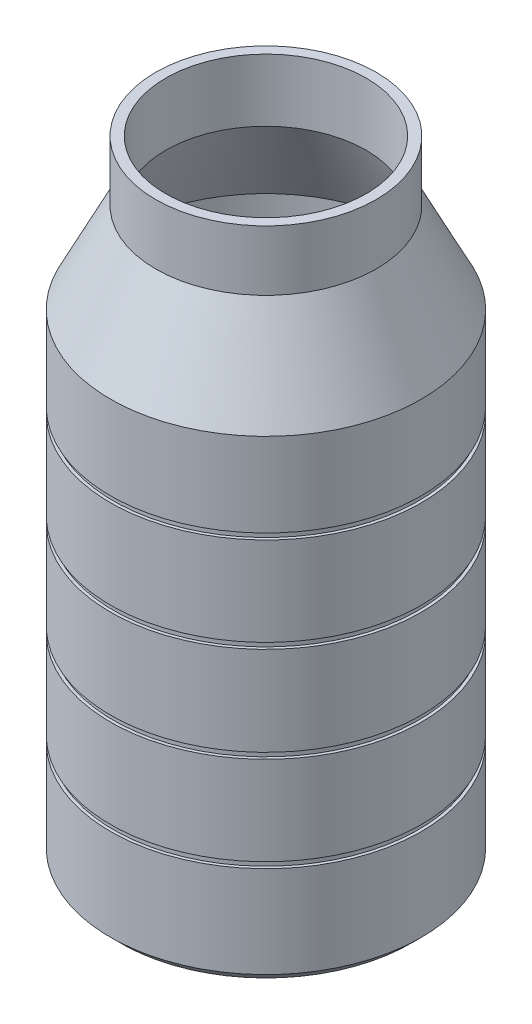
from build123d import *


with BuildPart() as part:
    # Sketch1 → Bottle_body_revolve (revolve)
    with BuildSketch(Plane.XY, mode=Mode.PRIVATE) as bottle_body_revolve_sk:
        Polygon((0, 0), (29, 0), (31, 2), (31, 20.3), (30.4, 20.3), (30.4, 21.5), (31, 21.5), (31, 39.2), (30.4, 39.2), (30.4, 40.4), (31, 40.4), (31, 58.2), (30.4, 58.2), (30.4, 59.4), (31, 59.4), (31, 77.1), (30.4, 77.1), (30.4, 78.3), (31, 78.3), (31, 95), (22, 113), (22, 125), (20, 125), (20, 112.53), (29, 94.53), (29, 2), (0, 2), align=None)
    revolve(bottle_body_revolve_sk.sketch.rotate(Axis((0, -10, 0), (0, 1, 0)), 90), axis=Axis((0, -10, 0), (0, 1, 0)))


solid = part.part
